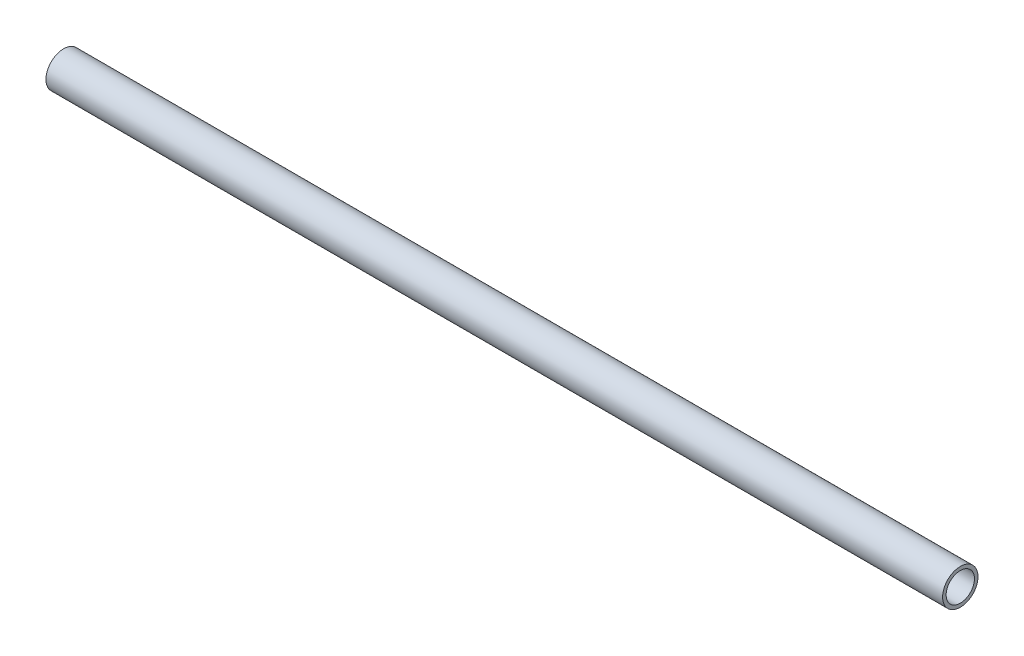
from build123d import *

# Parameters (mm, degrees)
SKETCH1_R                    = 9.525
SKETCH1_R_2                  = 7.62
EXTRUDE_THIN1_DEPTH          = 241.3
K_0_281_DIAMETER_HOLE1_D     = 7.1374
K_0_281_DIAMETER_HOLE1_DEPTH = 9.524
K_0_281_DIAMETER_HOLE1_TIP   = 2.144291291


with BuildPart() as part:
    # Sketch1 → Extrude-Thin1 (new, symmetric)
    with BuildSketch(Plane(origin=(0, 0, 0), x_dir=(0, 0, -1), z_dir=(1, 0, 0))):
        Circle(SKETCH1_R)
        Circle(SKETCH1_R_2, mode=Mode.SUBTRACT)
    extrude(amount=EXTRUDE_THIN1_DEPTH, both=True)

    # K (0.281) Diameter Hole1
    with Locations(Plane(origin=(204.47, 0, -9.525), x_dir=(-1, 0, 0), z_dir=(0, 0, -1))):
        with Locations((0, 0)):
            Hole(K_0_281_DIAMETER_HOLE1_D / 2, depth=K_0_281_DIAMETER_HOLE1_DEPTH)
            with Locations((0, 0, -(K_0_281_DIAMETER_HOLE1_DEPTH + K_0_281_DIAMETER_HOLE1_TIP / 2))):  # 118° drill point
                Cone(0, K_0_281_DIAMETER_HOLE1_D / 2, K_0_281_DIAMETER_HOLE1_TIP, mode=Mode.SUBTRACT)


solid = part.part
